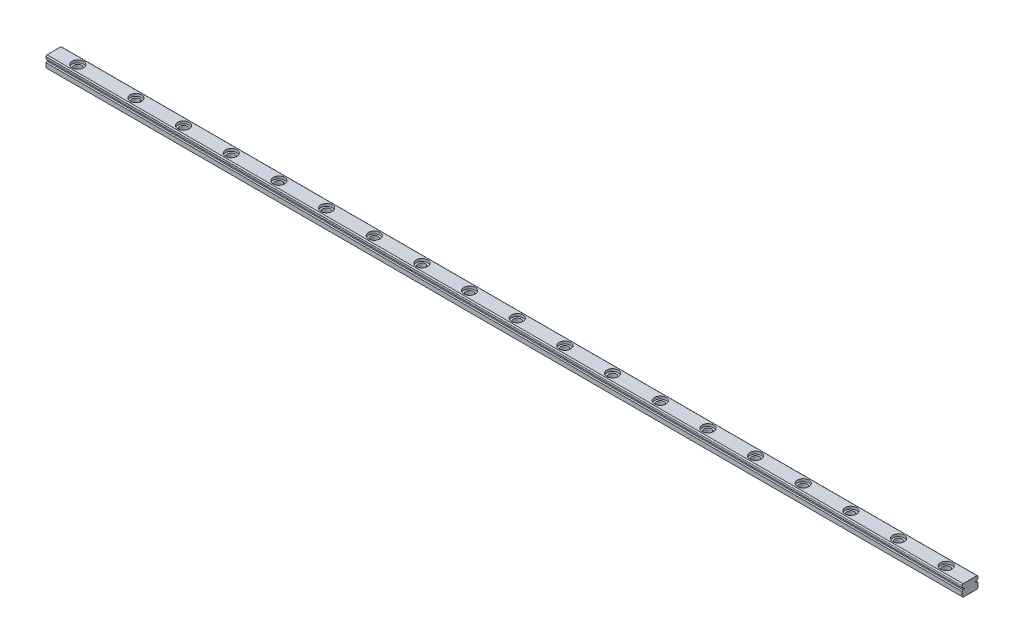
from build123d import *

# Parameters (mm, degrees)
EXTRUDE1_DEPTH  = 288.29
LPATTERN1_COUNT = 18
LPATTERN1_PITCH = 15


with BuildPart() as part:
    # Sketch1 → Extrude1 (new body)
    with BuildSketch(Plane(origin=(0, 0, 0), x_dir=(0, 0, -1), z_dir=(1, 0, 0))):
        with BuildLine():
            Line((-2.5, 0.3), (-2.2, 0))
            Line((-2.2, 0), (2.2, 0))
            Line((2.2, 0), (2.5, 0.3))
            Line((2.5, 0.3), (2.5, 1.723030399))
            ThreePointArc((2.5, 1.723030399), (2.315825857, 1.828075757), (2.191742431, 2))
            Line((2.191742431, 2), (1.85, 2))
            ThreePointArc((1.85, 2), (1.779289322, 2.029289322), (1.75, 2.1))
            Line((1.75, 2.1), (1.75, 2.3))
            ThreePointArc((1.75, 2.3), (1.779289322, 2.370710678), (1.85, 2.4))
            Line((1.85, 2.4), (2.191742431, 2.4))
            ThreePointArc((2.191742431, 2.4), (2.315825857, 2.571924243), (2.5, 2.676969601))
            Line((2.5, 2.676969601), (2.5, 3.3))
            ThreePointArc((2.5, 3.3), (2.393651515, 3.532738637), (2.2, 3.7))
            Line((2.2, 3.7), (-2.2, 3.7))
            ThreePointArc((-2.2, 3.7), (-2.393651515, 3.532738637), (-2.5, 3.3))
            Line((-2.5, 3.3), (-2.5, 2.676969601))
            ThreePointArc((-2.5, 2.676969601), (-2.315825857, 2.571924243), (-2.191742431, 2.4))
            Line((-2.191742431, 2.4), (-1.85, 2.4))
            ThreePointArc((-1.85, 2.4), (-1.779289322, 2.370710678), (-1.75, 2.3))
            Line((-1.75, 2.3), (-1.75, 2.1))
            ThreePointArc((-1.75, 2.1), (-1.779289322, 2.029289322), (-1.85, 2))
            Line((-1.85, 2), (-2.191742431, 2))
            ThreePointArc((-2.191742431, 2), (-2.315825857, 1.828075757), (-2.5, 1.723030399))
            Line((-2.5, 1.723030399), (-2.5, 0.3))
        make_face()
    extrude(amount=EXTRUDE1_DEPTH)

    # Sketch2 → Cut-Revolve1 (revolve, cut)
    with BuildSketch(Plane(origin=(0, 0, 0), x_dir=(-1, 0, 0), z_dir=(0, 0, -1))):
        Polygon((-7.5, 3.7), (-5.7, 3.7), (-5.7, 2.9), (-6.3, 2.9), (-6.3, 0.2), (-6.1, 0), (-7.5, 0), align=None)
    revolve(axis=Axis((7.5, 0, 0), (0, 1, 0)), mode=Mode.SUBTRACT)

    # Sketch3 → Cut-Revolve2 (revolve, cut)
    with BuildSketch(Plane(origin=(45, 0, 0), x_dir=(-1, 0, 0), z_dir=(0, 0, -1))):
        Polygon((-235.79, 3.7), (-233.99, 3.7), (-233.99, 2.9), (-234.59, 2.9), (-234.59, 0.2), (-234.39, 0), (-235.79, 0), align=None)
    cut_revolve2 = revolve(axis=Axis((280.79, 0, 0), (0, 1, 0)), mode=Mode.SUBTRACT)

    # LPattern1: Cut-Revolve2 ×18
    with Locations(*[(-i * LPATTERN1_PITCH, 0, 0) for i in range(1, LPATTERN1_COUNT)]):
        add(cut_revolve2, mode=Mode.SUBTRACT)


solid = part.part
